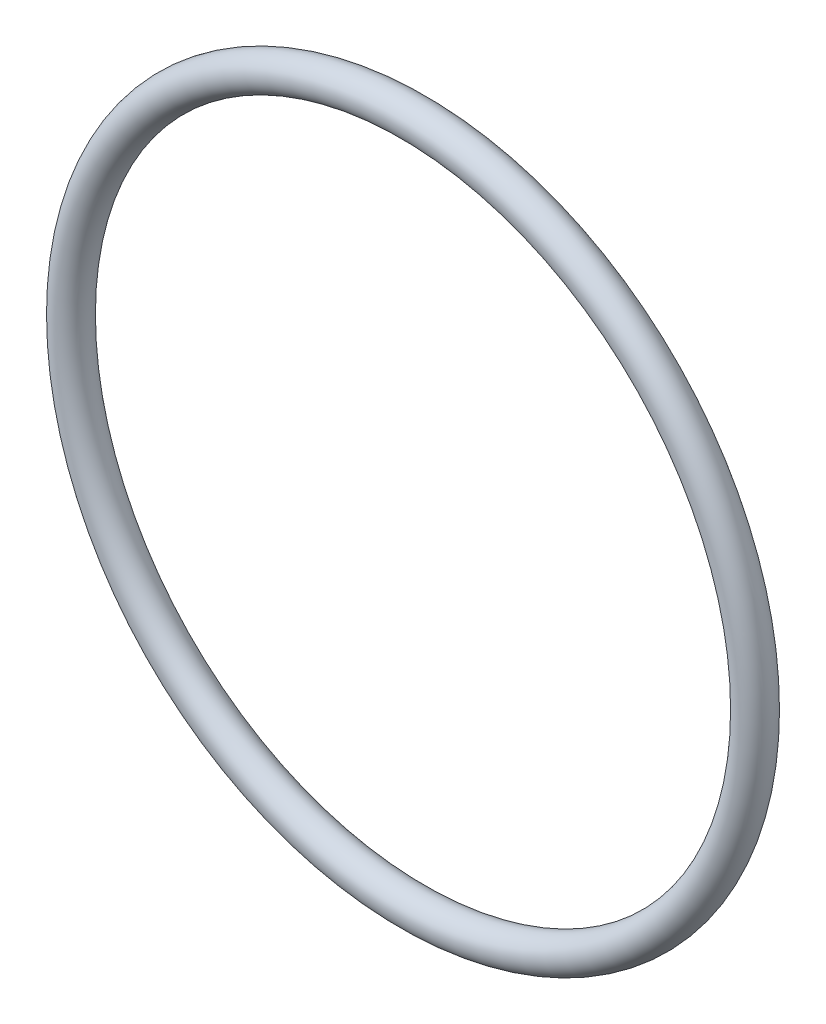
from build123d import *

# Parameters (mm, degrees)
SKETCH1_R = 0.8255


with BuildPart() as part:
    # Sketch1 → Revolve1 (revolve)
    with BuildSketch(Plane(origin=(0, 0, 0), x_dir=(1, 0, 0), z_dir=(0, 1, 0)), mode=Mode.PRIVATE) as revolve1_sk:
        with Locations((16.3195, 0)):
            Circle(SKETCH1_R)
    revolve(revolve1_sk.sketch.rotate(Axis((0, 0, -45.026054909), (0, 0, 1)), 180), axis=Axis((0, 0, -45.026054909), (0, 0, 1)))


solid = part.part
